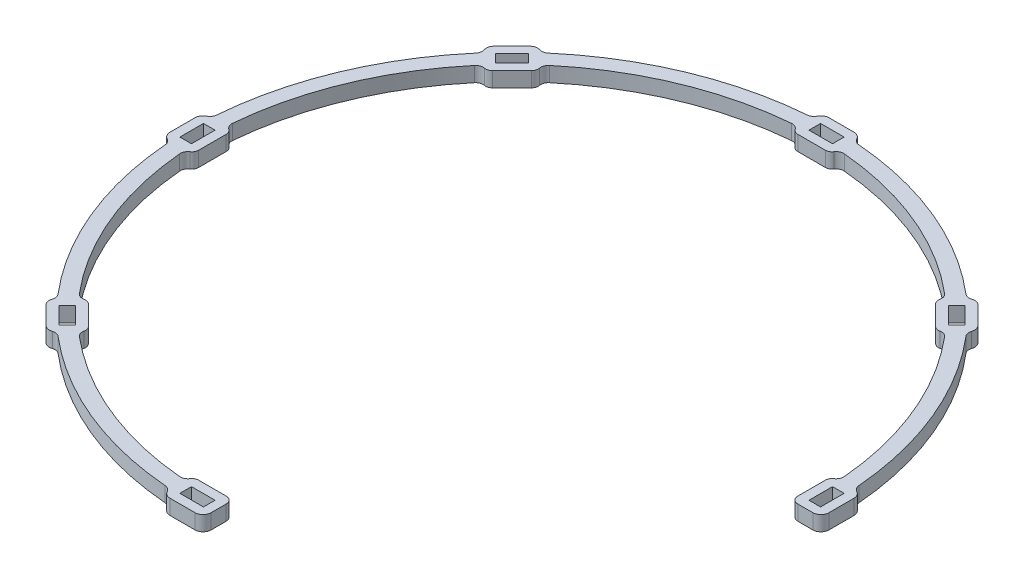
from build123d import *

# Parameters (mm, degrees)
BOSS_EXTRUDE1_DEPTH = 4
BOSS_EXTRUDE2_DEPTH = 4
CUT_EXTRUDE1_REACH  = 126.515
SKETCH3_W           = 6.3
SKETCH3_H           = 3.1
SKETCH3_W_2         = 3.1
SKETCH3_H_2         = 6.3
FILLET1_R           = 2


with BuildPart() as part:
    # Sketch1 → Boss-Extrude1 (new body)
    with BuildSketch(Plane(origin=(0, 0, 0), x_dir=(1, 0, 0), z_dir=(0, 1, 0))):
        with BuildLine():
            Line((2.38372093, -81.965345571), (2.5, -85.963655111))
            ThreePointArc((2.5, -85.963655111), (-60.811183182, 60.811183182), (85.963655111, -2.5))
            Line((85.963655111, -2.5), (81.965345571, -2.38372093))
            ThreePointArc((81.965345571, -2.38372093), (-57.982756057, 57.982756057), (2.38372093, -81.965345571))
        make_face()
    extrude(amount=BOSS_EXTRUDE1_DEPTH)

    # Sketch5 → Boss-Extrude2 (add)
    with BuildSketch(Plane(origin=(0, 4, 0), x_dir=(1, 0, 0), z_dir=(0, 1, 0))):
        with BuildLine():
            Line((-61.741269624, -53.963095031), (-64.575782708, -56.797608115))
            ThreePointArc((-64.575782708, -56.797608115), (-65.213133669, -58.336309448), (-64.575782708, -59.875010781))
            Line((-64.575782708, -59.875010781), (-59.875010781, -64.575782708))
            ThreePointArc((-59.875010781, -64.575782708), (-58.336309448, -65.213133669), (-56.797608115, -64.575782708))
            Line((-56.797608115, -64.575782708), (-53.963095031, -61.741269624))
            ThreePointArc((-53.963095031, -61.741269624), (-53.431394003, -60.457629791), (-53.963095031, -59.173989959))
            Line((-53.963095031, -59.173989959), (-59.173989959, -53.963095031))
            ThreePointArc((-59.173989959, -53.963095031), (-60.457629791, -53.431394003), (-61.741269624, -53.963095031))
        make_face()
        with BuildLine():
            Line((-3.68465914, -80), (3.68465914, -80))
            ThreePointArc((3.68465914, -80), (4.968298972, -80.531701028), (5.5, -81.81534086))
            Line((5.5, -81.81534086), (5.5, -85.823947707))
            ThreePointArc((5.5, -85.823947707), (4.86264904, -87.36264904), (3.323947707, -88))
            Line((3.323947707, -88), (-3.323947707, -88))
            ThreePointArc((-3.323947707, -88), (-4.86264904, -87.36264904), (-5.5, -85.823947707))
            Line((-5.5, -85.823947707), (-5.5, -81.81534086))
            ThreePointArc((-5.5, -81.81534086), (-4.968298972, -80.531701028), (-3.68465914, -80))
        make_face()
        with BuildLine():
            Line((-81.81534086, 5.5), (-85.823947707, 5.5))
            ThreePointArc((-85.823947707, 5.5), (-87.36264904, 4.86264904), (-88, 3.323947707))
            Line((-88, 3.323947707), (-88, -3.323947707))
            ThreePointArc((-88, -3.323947707), (-87.36264904, -4.86264904), (-85.823947707, -5.5))
            Line((-85.823947707, -5.5), (-81.81534086, -5.5))
            ThreePointArc((-81.81534086, -5.5), (-80.531701028, -4.968298972), (-80, -3.68465914))
            Line((-80, -3.68465914), (-80, 3.68465914))
            ThreePointArc((-80, 3.68465914), (-80.531701028, 4.968298972), (-81.81534086, 5.5))
        make_face()
        with BuildLine():
            Line((-53.963095031, 61.741269624), (-56.797608115, 64.575782708))
            ThreePointArc((-56.797608115, 64.575782708), (-58.336309448, 65.213133669), (-59.875010781, 64.575782708))
            Line((-59.875010781, 64.575782708), (-64.575782708, 59.875010781))
            ThreePointArc((-64.575782708, 59.875010781), (-65.213133669, 58.336309448), (-64.575782708, 56.797608115))
            Line((-64.575782708, 56.797608115), (-61.741269624, 53.963095031))
            ThreePointArc((-61.741269624, 53.963095031), (-60.457629791, 53.431394003), (-59.173989959, 53.963095031))
            Line((-59.173989959, 53.963095031), (-53.963095031, 59.173989959))
            ThreePointArc((-53.963095031, 59.173989959), (-53.431394003, 60.457629791), (-53.963095031, 61.741269624))
        make_face()
        with BuildLine():
            Line((5.5, 81.81534086), (5.5, 85.823947707))
            ThreePointArc((5.5, 85.823947707), (4.86264904, 87.36264904), (3.323947707, 88))
            Line((3.323947707, 88), (-3.323947707, 88))
            ThreePointArc((-3.323947707, 88), (-4.86264904, 87.36264904), (-5.5, 85.823947707))
            Line((-5.5, 85.823947707), (-5.5, 81.81534086))
            ThreePointArc((-5.5, 81.81534086), (-4.968298972, 80.531701028), (-3.68465914, 80))
            Line((-3.68465914, 80), (3.68465914, 80))
            ThreePointArc((3.68465914, 80), (4.968298972, 80.531701028), (5.5, 81.81534086))
        make_face()
        with BuildLine():
            Line((61.741269624, 53.963095031), (64.575782708, 56.797608115))
            ThreePointArc((64.575782708, 56.797608115), (65.213133669, 58.336309448), (64.575782708, 59.875010781))
            Line((64.575782708, 59.875010781), (59.875010781, 64.575782708))
            ThreePointArc((59.875010781, 64.575782708), (58.336309448, 65.213133669), (56.797608115, 64.575782708))
            Line((56.797608115, 64.575782708), (53.963095031, 61.741269624))
            ThreePointArc((53.963095031, 61.741269624), (53.431394003, 60.457629791), (53.963095031, 59.173989959))
            Line((53.963095031, 59.173989959), (59.173989959, 53.963095031))
            ThreePointArc((59.173989959, 53.963095031), (60.457629791, 53.431394003), (61.741269624, 53.963095031))
        make_face()
        with BuildLine():
            Line((81.81534086, -5.5), (85.823947707, -5.5))
            ThreePointArc((85.823947707, -5.5), (87.36264904, -4.86264904), (88, -3.323947707))
            Line((88, -3.323947707), (88, 3.323947707))
            ThreePointArc((88, 3.323947707), (87.36264904, 4.86264904), (85.823947707, 5.5))
            Line((85.823947707, 5.5), (81.81534086, 5.5))
            ThreePointArc((81.81534086, 5.5), (80.531701028, 4.968298972), (80, 3.68465914))
            Line((80, 3.68465914), (80, -3.68465914))
            ThreePointArc((80, -3.68465914), (80.531701028, -4.968298972), (81.81534086, -5.5))
        make_face()
    extrude(amount=-BOSS_EXTRUDE2_DEPTH)

    # Sketch3 → Cut-Extrude1 (cut, up to next)
    with BuildSketch(Plane(origin=(0, 4, 0), x_dir=(1, 0, 0), z_dir=(0, 1, 0)), mode=Mode.PRIVATE) as cut_extrude1_sk1:
        Polygon((-62.720371491, -58.26559877), (-58.26559877, -62.720371491), (-56.073567748, -60.52834047), (-60.52834047, -56.073567748), align=None)
    cut_extrude1_tool1 = extrude(cut_extrude1_sk1.sketch, amount=-CUT_EXTRUDE1_REACH, mode=Mode.PRIVATE) & part.part
    # Sketch3 → Cut-Extrude1 (cut, up to next)
    with BuildSketch(Plane(origin=(0, 4, 0), x_dir=(1, 0, 0), z_dir=(0, 1, 0)), mode=Mode.PRIVATE) as cut_extrude1_sk2:
        with Locations((0, -84)):
            Rectangle(SKETCH3_W, SKETCH3_H)
    cut_extrude1_tool2 = extrude(cut_extrude1_sk2.sketch, amount=-CUT_EXTRUDE1_REACH, mode=Mode.PRIVATE) & part.part
    # Sketch3 → Cut-Extrude1 (cut, up to next)
    with BuildSketch(Plane(origin=(0, 4, 0), x_dir=(1, 0, 0), z_dir=(0, 1, 0)), mode=Mode.PRIVATE) as cut_extrude1_sk3:
        with Locations((-84, 0)):
            Rectangle(SKETCH3_W_2, SKETCH3_H_2)
    cut_extrude1_tool3 = extrude(cut_extrude1_sk3.sketch, amount=-CUT_EXTRUDE1_REACH, mode=Mode.PRIVATE) & part.part
    # Sketch3 → Cut-Extrude1 (cut, up to next)
    with BuildSketch(Plane(origin=(0, 4, 0), x_dir=(1, 0, 0), z_dir=(0, 1, 0)), mode=Mode.PRIVATE) as cut_extrude1_sk4:
        Polygon((-58.26559877, 62.720371491), (-62.720371491, 58.26559877), (-60.52834047, 56.073567748), (-56.073567748, 60.52834047), align=None)
    cut_extrude1_tool4 = extrude(cut_extrude1_sk4.sketch, amount=-CUT_EXTRUDE1_REACH, mode=Mode.PRIVATE) & part.part
    # Sketch3 → Cut-Extrude1 (cut, up to next)
    with BuildSketch(Plane(origin=(0, 4, 0), x_dir=(1, 0, 0), z_dir=(0, 1, 0)), mode=Mode.PRIVATE) as cut_extrude1_sk5:
        with Locations((0, 84)):
            Rectangle(SKETCH3_W, SKETCH3_H)
    cut_extrude1_tool5 = extrude(cut_extrude1_sk5.sketch, amount=-CUT_EXTRUDE1_REACH, mode=Mode.PRIVATE) & part.part
    # Sketch3 → Cut-Extrude1 (cut, up to next)
    with BuildSketch(Plane(origin=(0, 4, 0), x_dir=(1, 0, 0), z_dir=(0, 1, 0)), mode=Mode.PRIVATE) as cut_extrude1_sk6:
        Polygon((62.720371491, 58.26559877), (58.26559877, 62.720371491), (56.073567748, 60.52834047), (60.52834047, 56.073567748), align=None)
    cut_extrude1_tool6 = extrude(cut_extrude1_sk6.sketch, amount=-CUT_EXTRUDE1_REACH, mode=Mode.PRIVATE) & part.part
    # Sketch3 → Cut-Extrude1 (cut, up to next)
    with BuildSketch(Plane(origin=(0, 4, 0), x_dir=(1, 0, 0), z_dir=(0, 1, 0)), mode=Mode.PRIVATE) as cut_extrude1_sk7:
        with Locations((84, 0)):
            Rectangle(SKETCH3_W_2, SKETCH3_H_2)
    cut_extrude1_tool7 = extrude(cut_extrude1_sk7.sketch, amount=-CUT_EXTRUDE1_REACH, mode=Mode.PRIVATE) & part.part
    add(cut_extrude1_tool1.solids().sort_by_distance((-59.39697, 4, 59.39697))[0], mode=Mode.SUBTRACT)
    add(cut_extrude1_tool2.solids().sort_by_distance((0, 4, 84))[0], mode=Mode.SUBTRACT)
    add(cut_extrude1_tool3.solids().sort_by_distance((-84, 4, 0))[0], mode=Mode.SUBTRACT)
    add(cut_extrude1_tool4.solids().sort_by_distance((-59.39697, 4, -59.39697))[0], mode=Mode.SUBTRACT)
    add(cut_extrude1_tool5.solids().sort_by_distance((0, 4, -84))[0], mode=Mode.SUBTRACT)
    add(cut_extrude1_tool6.solids().sort_by_distance((59.39697, 4, -59.39697))[0], mode=Mode.SUBTRACT)
    add(cut_extrude1_tool7.solids().sort_by_distance((84, 4, 0))[0], mode=Mode.SUBTRACT)

    # Fillet1
    fillet1_edges = [part.edges().sort_by_distance(p)[0] for p in [
        (5.5, 2, -85.823947707),
        (5.5, 2, -81.81534086),
        (-5.5, 2, -81.81534086),
        (-5.5, 2, -85.823947707),
        (64.575782708, 2, -56.797608115),
        (61.741269624, 2, -53.963095031),
        (53.963095031, 2, -61.741269624),
        (56.797608115, 2, -64.575782708),
        (81.81534086, 2, -5.5),
        (85.823947707, 2, -5.5),
        (-5.5, 2, 85.823947707),
        (-5.5, 2, 81.81534086),
        (-64.575782708, 2, 56.797608115),
        (-61.741269624, 2, 53.963095031),
        (-53.963095031, 2, 61.741269624),
        (-56.797608115, 2, 64.575782708),
        (-85.823947707, 2, -5.5),
        (-81.81534086, 2, -5.5),
        (-81.81534086, 2, 5.5),
        (-85.823947707, 2, 5.5),
        (-56.797608115, 2, -64.575782708),
        (-53.963095031, 2, -61.741269624),
        (-61.741269624, 2, -53.963095031),
        (-64.575782708, 2, -56.797608115),
    ]]
    fillet(fillet1_edges, radius=FILLET1_R)


solid = part.part
